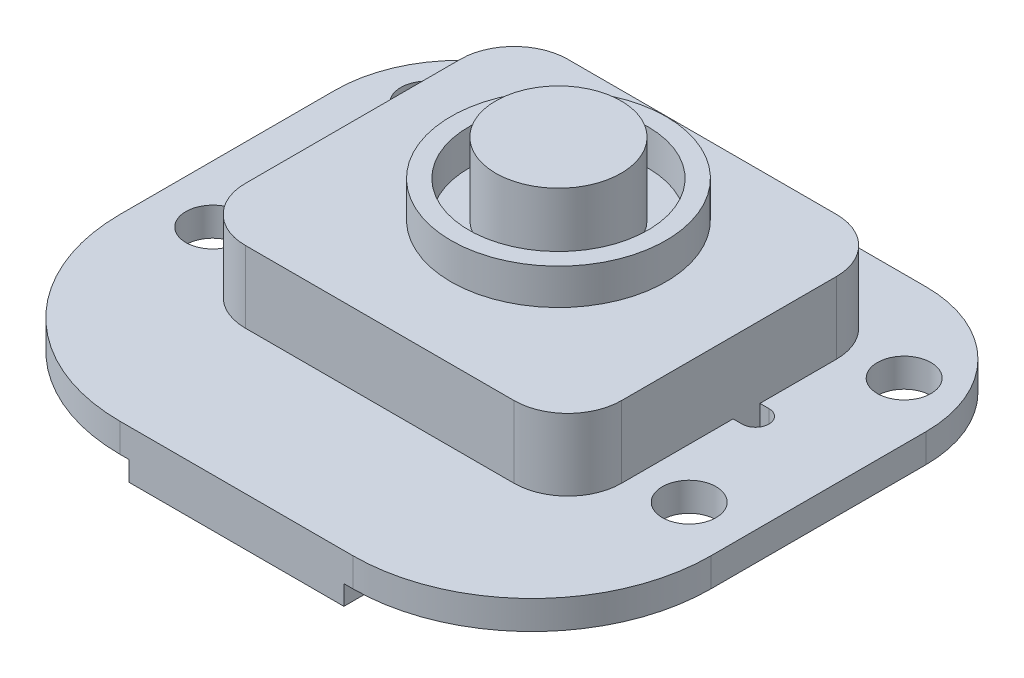
from build123d import *

# Parameters (mm, degrees)
SKETCH_1_R           = 1.5
EXTRUDE_1_DEPTH      = 1.6
EXTRUDE_2_DEPTH      = 5.6
SKETCH_3_R           = 6
SKETCH_3_R_2         = 5
EXTRUDE_3_DEPTH      = 7.6
SKETCH_4_R           = 3.5
SKETCH_4_R_2         = 2.75
EXTRUDE_4_DEPTH      = 9.6
SKETCH_5_R           = 3.5
EXTRUDE_5_DEPTH      = 9.6
EXTRUDE_6_DEPTH      = 0.001
EXTRUDE_6_DEPTH_BACK = 1.1
SKETCH_7_W           = 12
SKETCH_7_H           = 4.716784086


with BuildPart() as part:
    # 草图1 → 凸台-拉伸1 (new body)
    with BuildSketch(Plane(origin=(0, 0, 0), x_dir=(1, 0, 0), z_dir=(0, 1, 0))):
        with BuildLine():
            Line((-9.5, 11.022466342), (9.5, 11.022466342))
            ThreePointArc((9.5, 11.022466342), (14.449747468, 8.97221381), (16.5, 4.022466342))
            Line((16.5, 4.022466342), (16.5, -7.977533658))
            ThreePointArc((16.5, -7.977533658), (13.571067812, -15.04860147), (6.5, -17.977533658))
            Line((6.5, -17.977533658), (-6.5, -17.977533658))
            ThreePointArc((-6.5, -17.977533658), (-13.571067812, -15.04860147), (-16.5, -7.977533658))
            Line((-16.5, -7.977533658), (-16.5, 4.022466342))
            ThreePointArc((-16.5, 4.022466342), (-14.449747468, 8.97221381), (-9.5, 11.022466342))
        make_face()
        with Locations(Location((-13.3, 6, 0), (0, 0, 270))):
            Circle(SKETCH_1_R, mode=Mode.SUBTRACT)
        with Locations(Location((13.3, 6, 0), (0, 0, 270))):
            Circle(SKETCH_1_R, mode=Mode.SUBTRACT)
        with Locations(Location((-13.3, -6, 0), (0, 0, 270))):
            Circle(SKETCH_1_R, mode=Mode.SUBTRACT)
        with Locations(Location((13.3, -6, 0), (0, 0, 270))):
            Circle(SKETCH_1_R, mode=Mode.SUBTRACT)
        with BuildLine():
            Line((-11, 0.75), (-10, 0.75))
            ThreePointArc((-10, 0.75), (-9.25, 0), (-10, -0.75))
            Line((-10, -0.75), (-11, -0.75))
            ThreePointArc((-11, -0.75), (-11.75, 0), (-11, 0.75))
        make_face(mode=Mode.SUBTRACT)
        with BuildLine():
            Line((11, 0.75), (10, 0.75))
            ThreePointArc((10, 0.75), (9.25, 0), (10, -0.75))
            Line((10, -0.75), (11, -0.75))
            ThreePointArc((11, -0.75), (11.75, 0), (11, 0.75))
        make_face(mode=Mode.SUBTRACT)
    extrude(amount=EXTRUDE_1_DEPTH)

    # 草图2 → 凸台-拉伸2 (add)
    with BuildSketch(Plane(origin=(0, 0, 0), x_dir=(1, 0, 0), z_dir=(0, 1, 0))):
        with BuildLine():
            Line((-7.5, 8.022466342), (7.5, 8.022466342))
            ThreePointArc((7.5, 8.022466342), (9.621320344, 7.143786685), (10.5, 5.022466342))
            Line((10.5, 5.022466342), (10.5, -6.977533658))
            ThreePointArc((10.5, -6.977533658), (9.621320344, -9.098854002), (7.5, -9.977533658))
            Line((7.5, -9.977533658), (-7.5, -9.977533658))
            ThreePointArc((-7.5, -9.977533658), (-9.621320344, -9.098854002), (-10.5, -6.977533658))
            Line((-10.5, -6.977533658), (-10.5, 5.022466342))
            ThreePointArc((-10.5, 5.022466342), (-9.621320344, 7.143786685), (-7.5, 8.022466342))
        make_face()
    extrude(amount=EXTRUDE_2_DEPTH)

    # 草图3 → 凸台-拉伸3 (add)
    with BuildSketch(Plane(origin=(0, 0, 0), x_dir=(1, 0, 0), z_dir=(0, 1, 0))):
        with Locations(Location((0, 0, 0), (0, 0, 90))):
            Circle(SKETCH_3_R)
        with Locations(Location((0, 0, 0), (0, 0, 90))):
            Circle(SKETCH_3_R_2, mode=Mode.SUBTRACT)
    extrude(amount=EXTRUDE_3_DEPTH)

    # 草图4 → 凸台-拉伸4 (add)
    with BuildSketch(Plane(origin=(0, 0, 0), x_dir=(1, 0, 0), z_dir=(0, 1, 0))):
        with Locations(Location((0, 0, 0), (0, 0, 270))):
            Circle(SKETCH_4_R)
        with Locations(Location((0, 0, 0), (0, 0, 270))):
            Circle(SKETCH_4_R_2, mode=Mode.SUBTRACT)
    extrude(amount=EXTRUDE_4_DEPTH)

    # 草图5 → 凸台-拉伸5 (add)
    with BuildSketch(Plane(origin=(0, 0, 0), x_dir=(1, 0, 0), z_dir=(0, 1, 0))):
        with Locations(Location((0, 0, 0), (0, 0, 270))):
            Circle(SKETCH_5_R)
    extrude(amount=EXTRUDE_5_DEPTH)

    # 草图7 → 凸台-拉伸6 (add, two sides: drawn at the far end of the back side and taken through both)
    with BuildSketch(Plane(origin=(0, 0, 0), x_dir=(1, 0, 0), z_dir=(0, 1, 0)).offset(-EXTRUDE_6_DEPTH_BACK)):
        with Locations((0, -15.619141615)):
            Rectangle(SKETCH_7_W, SKETCH_7_H)
    extrude(amount=EXTRUDE_6_DEPTH + EXTRUDE_6_DEPTH_BACK)


solid = part.part
